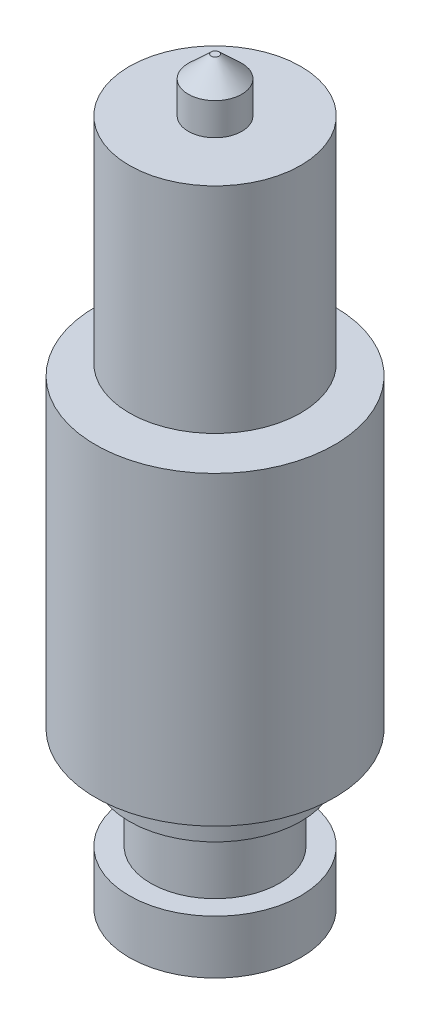
from build123d import *

# Parameters (mm, degrees)
SKETCH1_R           = 8
BOSS_EXTRUDE1_DEPTH = 5
SKETCH2_R           = 6
BOSS_EXTRUDE2_DEPTH = 6
SKETCH3_R           = 8
BOSS_EXTRUDE3_DEPTH = 1.5
SKETCH4_R           = 5
BOSS_EXTRUDE4_DEPTH = 2
SKETCH5_R           = 11.15
BOSS_EXTRUDE5_DEPTH = 28.5
SKETCH6_R           = 2
BOSS_EXTRUDE6_DEPTH = 1
SKETCH7_R           = 8
BOSS_EXTRUDE7_DEPTH = 20
SKETCH8_R           = 2.5
BOSS_EXTRUDE8_DEPTH = 3
SKETCH9_R           = 2.5
BOSS_EXTRUDE9_DEPTH = 2
BOSS_EXTRUDE9_TAPER = 47


with BuildPart() as part:
    # Sketch1 → Boss-Extrude1 (new body)
    with BuildSketch(Plane(origin=(0, 0, 0), x_dir=(1, 0, 0), z_dir=(0, 1, 0))):
        with Locations(Location((0, 0, 0), (0, 0, 270))):
            Circle(SKETCH1_R)
    extrude(amount=BOSS_EXTRUDE1_DEPTH)

    # Sketch2 → Boss-Extrude2 (add)
    with BuildSketch(Plane(origin=(0, 5, 0), x_dir=(1, 0, 0), z_dir=(0, 1, 0))):
        with Locations(Location((0, 0, 0), (0, 0, 270))):
            Circle(SKETCH2_R)
    extrude(amount=BOSS_EXTRUDE2_DEPTH)

    # Sketch3 → Boss-Extrude3 (add)
    with BuildSketch(Plane(origin=(0, 11, 0), x_dir=(1, 0, 0), z_dir=(0, 1, 0))):
        with Locations(Location((0, 0, 0), (0, 0, 270))):
            Circle(SKETCH3_R)
    extrude(amount=BOSS_EXTRUDE3_DEPTH)

    # Sketch4 → Boss-Extrude4 (add)
    with BuildSketch(Plane(origin=(0, 12.5, 0), x_dir=(1, 0, 0), z_dir=(0, 1, 0))):
        with Locations(Location((0, 0, 0), (0, 0, 270))):
            Circle(SKETCH4_R)
    extrude(amount=BOSS_EXTRUDE4_DEPTH)

    # Sketch5 → Boss-Extrude5 (add)
    with BuildSketch(Plane(origin=(0, 14.5, 0), x_dir=(1, 0, 0), z_dir=(0, 1, 0))):
        with Locations(Location((0, 0, 0), (0, 0, 90))):
            Circle(SKETCH5_R)
    extrude(amount=BOSS_EXTRUDE5_DEPTH)

    # Sketch6 → Boss-Extrude6 (add)
    with BuildSketch(Plane(origin=(0, 43, 0), x_dir=(1, 0, 0), z_dir=(0, 1, 0))):
        with Locations(Location((0, 0, 0), (0, 0, 270))):
            Circle(SKETCH6_R)
    extrude(amount=BOSS_EXTRUDE6_DEPTH)

    # Sketch7 → Boss-Extrude7 (add)
    with BuildSketch(Plane(origin=(0, 44, 0), x_dir=(1, 0, 0), z_dir=(0, 1, 0))):
        with Locations(Location((0, 0, 0), (0, 0, 270))):
            Circle(SKETCH7_R)
    extrude(amount=BOSS_EXTRUDE7_DEPTH)

    # Sketch8 → Boss-Extrude8 (add)
    with BuildSketch(Plane(origin=(0, 64, 0), x_dir=(1, 0, 0), z_dir=(0, 1, 0))):
        with Locations(Location((0, 0, 0), (0, 0, 270))):
            Circle(SKETCH8_R)
    extrude(amount=BOSS_EXTRUDE8_DEPTH)

    # Sketch9 → Boss-Extrude9 (add)
    with BuildSketch(Plane(origin=(0, 67, 0), x_dir=(1, 0, 0), z_dir=(0, 1, 0))):
        with Locations(Location((0, 0, 0), (0, 0, 270))):
            Circle(SKETCH9_R)
    extrude(amount=BOSS_EXTRUDE9_DEPTH, taper=BOSS_EXTRUDE9_TAPER)


solid = part.part
